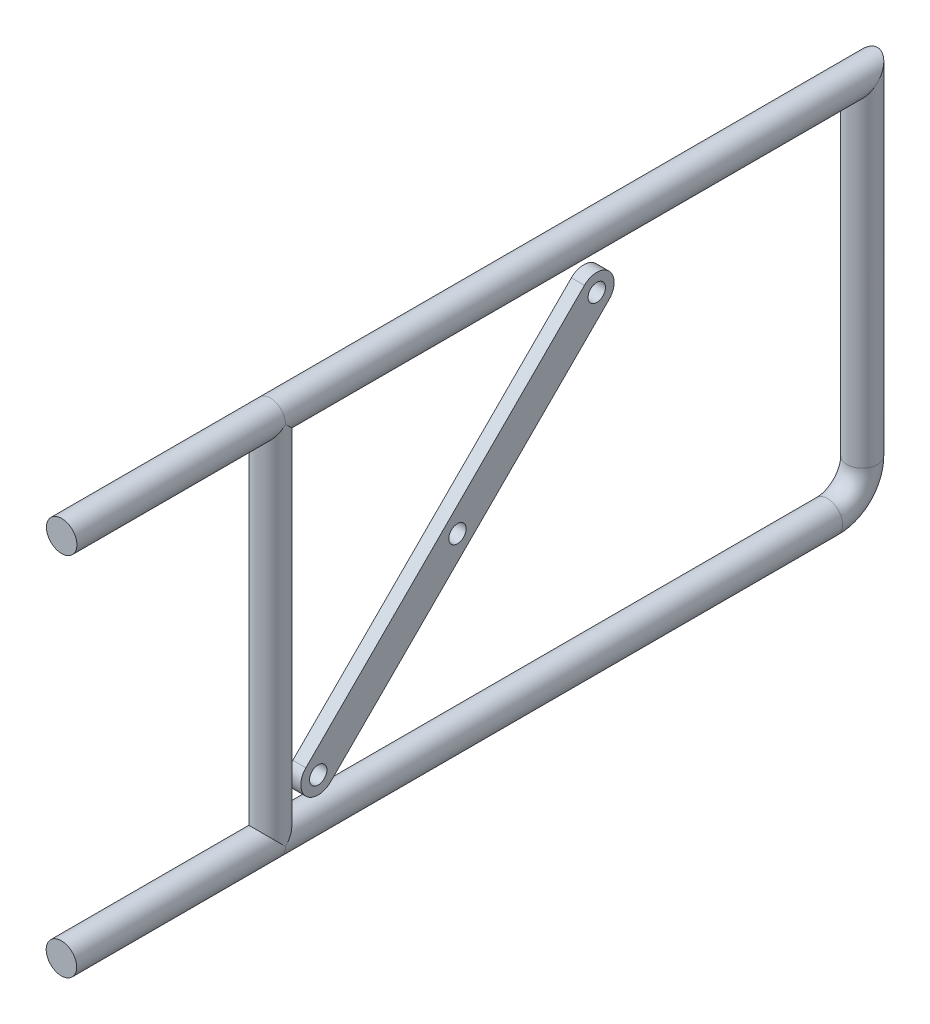
from build123d import *

# Parameters (mm, degrees)
SKETCH3_R           = 11.1125
SKETCH3_8_R         = 11.1125
SKETCH11_R          = 6.35
BOSS_EXTRUDE1_DEPTH = 9.525


with BuildPart() as part:
    # Sweep1: sweep along a path in Sketch1
    with BuildLine(Plane(origin=(0, 0, 0), x_dir=(0, 0, -1), z_dir=(1, 0, 0))) as sweep1_path:
        Line((0, -431.8), (152.212779539, -431.8))
        Line((152.212779539, -431.8), (584.012779539, -431.8))
        Line((584.012779539, -431.8), (584.012779539, -673.1))
        ThreePointArc((584.012779539, -673.1), (576.573291781, -691.060512242), (558.612779539, -698.5))
        Line((558.612779539, -698.5), (152.212779539, -698.5))
        Line((152.212779539, -698.5), (-0.187220461, -698.5))
    # Sketch3 → Sweep1 (sweep)
    with BuildSketch(Plane.XY):
        with Locations((0, -698.5)):
            Circle(SKETCH3_R)
    sweep(path=sweep1_path.line, transition=Transition.RIGHT)

    # Sweep2: sweep along a path in Sketch1<23>
    with BuildLine(Plane(origin=(0, 0, 0), x_dir=(0, 0, -1), z_dir=(1, 0, 0))) as sweep2_path:
        Line((-0.187220461, -698.5), (152.212779539, -698.5))
        Line((152.212779539, -698.5), (152.212779539, -431.8))
    # Sketch3<8> → Sweep2 (sweep)
    with BuildSketch(Plane.XY):
        with Locations((0, -698.5)):
            Circle(SKETCH3_8_R)
    sweep(path=sweep2_path.line, transition=Transition.RIGHT)


with BuildPart() as body_2:
    # Sketch11 → Boss-Extrude1 (new body)
    with BuildSketch(Plane(origin=(0, 0, 0), x_dir=(0, 0, -1), z_dir=(1, 0, 0))):
        with BuildLine():
            Line((389.79303566, -472.530256121), (186.59303566, -675.730256121))
            ThreePointArc((186.59303566, -675.730256121), (168.632523418, -675.730256121), (168.632523418, -657.769743879))
            Line((168.632523418, -657.769743879), (371.832523418, -454.569743879))
            ThreePointArc((371.832523418, -454.569743879), (389.79303566, -454.569743879), (389.79303566, -472.530256121))
        make_face()
        with Locations((177.612779539, -666.75)):
            Circle(SKETCH11_R, mode=Mode.SUBTRACT)
        with Locations((279.212779539, -565.15)):
            Circle(SKETCH11_R, mode=Mode.SUBTRACT)
        with Locations((380.812779539, -463.55)):
            Circle(SKETCH11_R, mode=Mode.SUBTRACT)
    extrude(amount=BOSS_EXTRUDE1_DEPTH)


solid = Compound([part.part, body_2.part])
